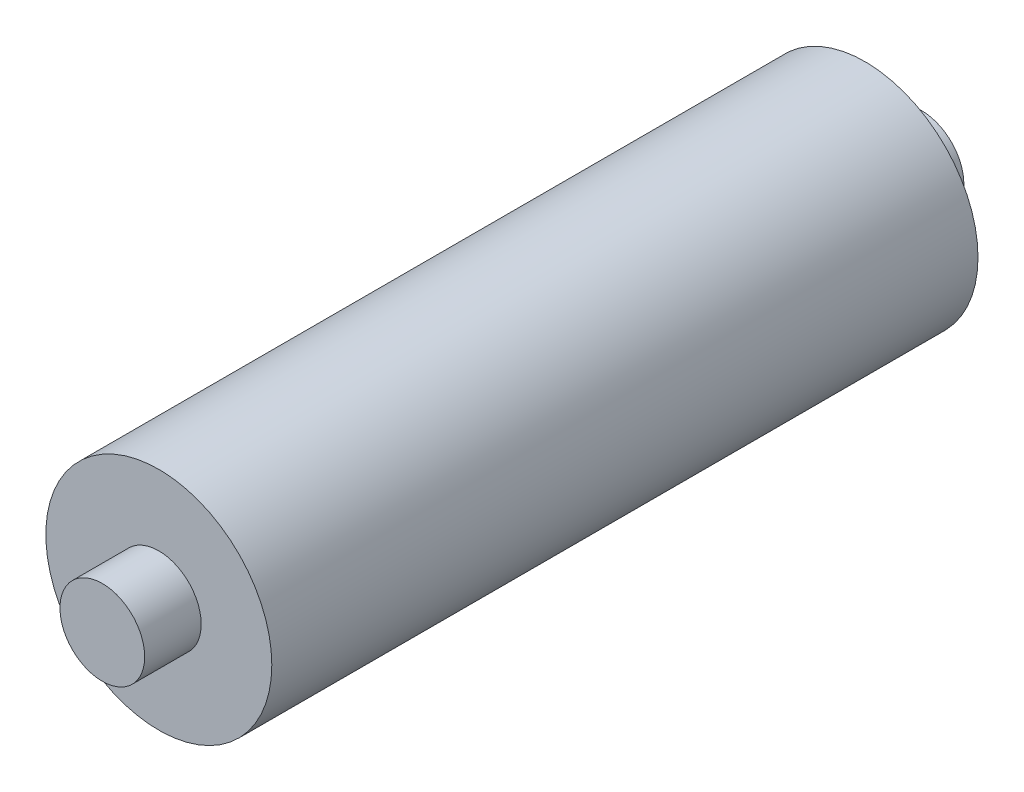
from build123d import *

# Parameters (mm, degrees)
SKETCH1_R           = 40
BOSS_EXTRUDE1_DEPTH = 250
SKETCH2_R           = 15
BOSS_EXTRUDE2_DEPTH = 20


with BuildPart() as part:
    # Sketch1 → Boss-Extrude1 (new body)
    with BuildSketch(Plane.XY):
        Circle(SKETCH1_R)
    extrude(amount=BOSS_EXTRUDE1_DEPTH)

    # Sketch2 → Boss-Extrude2 (add)
    with BuildSketch(Plane.XY.offset(250)):
        Circle(SKETCH2_R)
    boss_extrude2 = extrude(amount=BOSS_EXTRUDE2_DEPTH)

    # Mirror1: Boss-Extrude2 across plane
    add(boss_extrude2.mirror(Plane.XY.offset(125)))


solid = part.part
